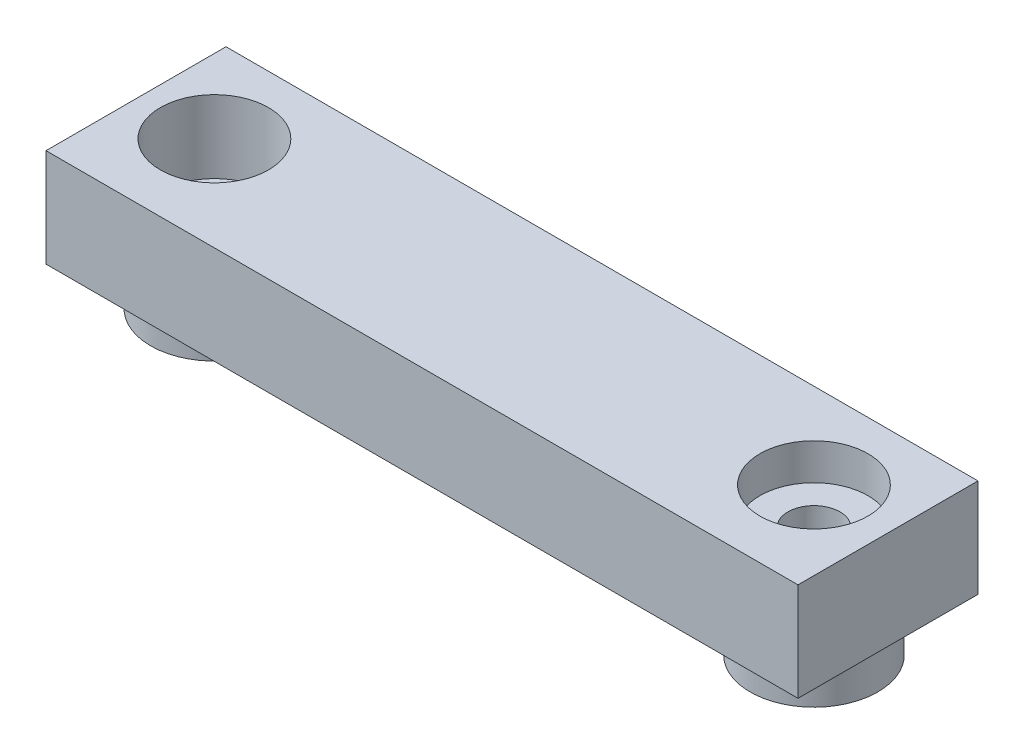
from build123d import *

# Parameters (mm, degrees)
CROQUIS2_W                                           = 76.512018684
CROQUIS2_H                                           = 18.314660831
SALIENTE_EXTRUIR1_DEPTH                              = 10
CROQUIS1_R                                           = 6.5
CROQUIS1_R_2                                         = 2.65
SALIENTE_EXTRUIR2_DEPTH                              = 5
CORTAR_EXTRUIR1_DEPTH                                = 31
CORTAR_EXTRUIR1_DEPTH_BACK                           = 50
CROQUIS4_R                                           = 2.5
REFRENTADO_PARA_TORNILLO_CON_CABEZA_TRON_D           = 5.3
REFRENTADO_PARA_TORNILLO_CON_CABEZA_TRON_CBORE_D     = 11
REFRENTADO_PARA_TORNILLO_CON_CABEZA_TRON_CBORE_DEPTH = 3.7
REFRENTADO_PARA_TORNILLO_CON_CABEZA_2_D              = 5.3
REFRENTADO_PARA_TORNILLO_CON_CABEZA_2_CBORE_D        = 11
REFRENTADO_PARA_TORNILLO_CON_CABEZA_2_CBORE_DEPTH    = 3.7
REFRENTADO_PARA_TORNILLO_CON_CABEZA_3_D              = 5.3
REFRENTADO_PARA_TORNILLO_CON_CABEZA_3_CBORE_D        = 11
REFRENTADO_PARA_TORNILLO_CON_CABEZA_3_CBORE_DEPTH    = 3.7


with BuildPart() as part:
    # Croquis2 → Saliente-Extruir1 (new body)
    with BuildSketch(Plane(origin=(0, 0, 0), x_dir=(1, 0, 0), z_dir=(0, 1, 0))):
        with Locations((0.23849107, 24.625561378)):
            Rectangle(CROQUIS2_W, CROQUIS2_H)
    extrude(amount=SALIENTE_EXTRUIR1_DEPTH)

    # Croquis1 → Saliente-Extruir2 (add)
    # profile 1 of 2: a face of its own
    with BuildSketch(Plane(origin=(0, 0, 0), x_dir=(1, 0, 0), z_dir=(0, 1, 0))):
        with Locations(Location((-30.5, 25.086633895, 0), (0, 0, 270))):
            Circle(CROQUIS1_R)
        with Locations(Location((-30.5, 25.086633895, 0), (0, 0, 270))):
            Circle(CROQUIS1_R_2, mode=Mode.SUBTRACT)
    # profile 2 of 2: a face of its own
    with BuildSketch(Plane(origin=(0, 0, 0), x_dir=(1, 0, 0), z_dir=(0, 1, 0))):
        with Locations(Location((30.5, 25.086633895, 0), (0, 0, 90))):
            Circle(CROQUIS1_R)
        with Locations(Location((30.5, 25.086633895, 0), (0, 0, 270))):
            Circle(CROQUIS1_R_2, mode=Mode.SUBTRACT)
    extrude(amount=-SALIENTE_EXTRUIR2_DEPTH)

    # Croquis4 → Cortar-Extruir1 (cut, two sides: drawn at the far end of the back side and taken through both)
    with BuildSketch(Plane.XZ.offset(-CORTAR_EXTRUIR1_DEPTH_BACK)):
        with Locations(Location((-30.5, -25.086633895, 0), (0, 0, 90))):
            Circle(CROQUIS4_R)
        with Locations(Location((30.5, -25.086633895, 0), (0, 0, 90))):
            Circle(CROQUIS4_R)
    extrude(amount=CORTAR_EXTRUIR1_DEPTH + CORTAR_EXTRUIR1_DEPTH_BACK, mode=Mode.SUBTRACT)

    # Refrentado para tornillo con cabeza tron (through all)
    with Locations(Plane(origin=(-30.5, 10, -25.086633895), x_dir=(0, 0, 1), z_dir=(0, 1, 0))):
        with Locations((0, 0)):
            CounterBoreHole(REFRENTADO_PARA_TORNILLO_CON_CABEZA_TRON_D / 2, REFRENTADO_PARA_TORNILLO_CON_CABEZA_TRON_CBORE_D / 2, REFRENTADO_PARA_TORNILLO_CON_CABEZA_TRON_CBORE_DEPTH)

    # Refrentado para tornillo con cabeza  2 (through all)
    with Locations(Plane(origin=(-30.5, 6.3, -25.086633895), x_dir=(0, 0, 1), z_dir=(0, 1, 0))):
        with Locations((0, 0)):
            CounterBoreHole(REFRENTADO_PARA_TORNILLO_CON_CABEZA_2_D / 2, REFRENTADO_PARA_TORNILLO_CON_CABEZA_2_CBORE_D / 2, REFRENTADO_PARA_TORNILLO_CON_CABEZA_2_CBORE_DEPTH)

    # Refrentado para tornillo con cabeza  3 (through all)
    with Locations(Plane(origin=(30.5, 10, -25.086633895), x_dir=(0, 0, 1), z_dir=(0, 1, 0))):
        with Locations((0, 0)):
            CounterBoreHole(REFRENTADO_PARA_TORNILLO_CON_CABEZA_3_D / 2, REFRENTADO_PARA_TORNILLO_CON_CABEZA_3_CBORE_D / 2, REFRENTADO_PARA_TORNILLO_CON_CABEZA_3_CBORE_DEPTH)


solid = part.part
